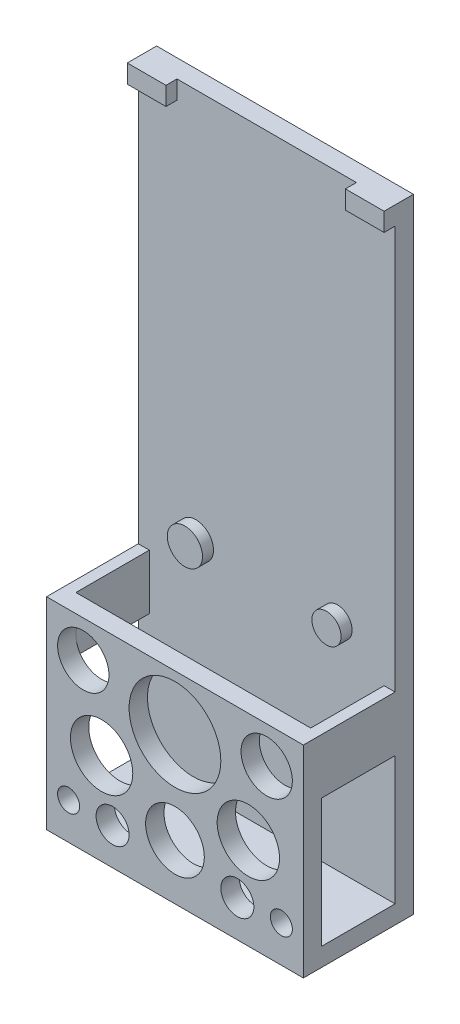
from build123d import *

# Parameters (mm, degrees)
SKETCH1_W           = 70
SKETCH1_H           = 170
BOSS_EXTRUDE1_DEPTH = 5
SKETCH2_W           = 70
SKETCH2_H           = 5
BOSS_EXTRUDE2_DEPTH = 25
SKETCH3_W           = 70
SKETCH3_H           = 5
BOSS_EXTRUDE3_DEPTH = 50
SKETCH4_W           = 3
SKETCH4_H           = 15
BOSS_EXTRUDE4_DEPTH = 20
CUT_EXTRUDE1_REACH  = 98.695
SKETCH6_R           = 12.5
SKETCH6_R_2         = 7
SKETCH6_R_3         = 8.5
SKETCH6_R_4         = 8
SKETCH6_R_5         = 4.5
SKETCH6_R_6         = 3
SKETCH7_R           = 4.797792648
SKETCH7_R_2         = 3.987535838
SKETCH7_W           = 10.549301712
SKETCH7_H           = 5.014130384
BOSS_EXTRUDE5_DEPTH = 3


with BuildPart() as part:
    # Sketch1 → Boss-Extrude1 (new body)
    with BuildSketch(Plane.XY):
        Rectangle(SKETCH1_W, SKETCH1_H)
    extrude(amount=BOSS_EXTRUDE1_DEPTH)

    # Sketch2 → Boss-Extrude2 (add)
    with BuildSketch(Plane.XY.offset(5)):
        with Locations((0, -82.5)):
            Rectangle(SKETCH2_W, SKETCH2_H)
    extrude(amount=BOSS_EXTRUDE2_DEPTH)

    # Sketch3 → Boss-Extrude3 (add)
    with BuildSketch(Plane(origin=(0, -80, 0), x_dir=(1, 0, 0), z_dir=(0, 1, 0))):
        with Locations((0, -27.5)):
            Rectangle(SKETCH3_W, SKETCH3_H)
    extrude(amount=BOSS_EXTRUDE3_DEPTH)

    # Sketch4 → Boss-Extrude4 (add)
    with BuildSketch(Plane.XY.offset(5)):
        with Locations((-33.5, -37.5)):
            Rectangle(SKETCH4_W, SKETCH4_H)
        with Locations((33.5, -37.5)):
            Rectangle(SKETCH4_W, SKETCH4_H)
    extrude(amount=BOSS_EXTRUDE4_DEPTH)

    # Sketch6 → Cut-Extrude1 (cut, up to next)
    with BuildSketch(Plane.XY.offset(30), mode=Mode.PRIVATE) as cut_extrude1_sk1:
        with Locations((0, -45)):
            Circle(SKETCH6_R)
    cut_extrude1_tool1 = extrude(cut_extrude1_sk1.sketch, amount=-CUT_EXTRUDE1_REACH, mode=Mode.PRIVATE) & part.part
    # Sketch6 → Cut-Extrude1 (cut, up to next)
    with BuildSketch(Plane.XY.offset(30), mode=Mode.PRIVATE) as cut_extrude1_sk2:
        with Locations((-25, -40)):
            Circle(SKETCH6_R_2)
    cut_extrude1_tool2 = extrude(cut_extrude1_sk2.sketch, amount=-CUT_EXTRUDE1_REACH, mode=Mode.PRIVATE) & part.part
    # Sketch6 → Cut-Extrude1 (cut, up to next)
    with BuildSketch(Plane.XY.offset(30), mode=Mode.PRIVATE) as cut_extrude1_sk3:
        with Locations((25, -40)):
            Circle(SKETCH6_R_2)
    cut_extrude1_tool3 = extrude(cut_extrude1_sk3.sketch, amount=-CUT_EXTRUDE1_REACH, mode=Mode.PRIVATE) & part.part
    # Sketch6 → Cut-Extrude1 (cut, up to next)
    with BuildSketch(Plane.XY.offset(30), mode=Mode.PRIVATE) as cut_extrude1_sk4:
        with Locations((-20, -60)):
            Circle(SKETCH6_R_3)
    cut_extrude1_tool4 = extrude(cut_extrude1_sk4.sketch, amount=-CUT_EXTRUDE1_REACH, mode=Mode.PRIVATE) & part.part
    # Sketch6 → Cut-Extrude1 (cut, up to next)
    with BuildSketch(Plane.XY.offset(30), mode=Mode.PRIVATE) as cut_extrude1_sk5:
        with Locations((20, -60)):
            Circle(SKETCH6_R_3)
    cut_extrude1_tool5 = extrude(cut_extrude1_sk5.sketch, amount=-CUT_EXTRUDE1_REACH, mode=Mode.PRIVATE) & part.part
    # Sketch6 → Cut-Extrude1 (cut, up to next)
    with BuildSketch(Plane.XY.offset(30), mode=Mode.PRIVATE) as cut_extrude1_sk6:
        with Locations((0, -70)):
            Circle(SKETCH6_R_4)
    cut_extrude1_tool6 = extrude(cut_extrude1_sk6.sketch, amount=-CUT_EXTRUDE1_REACH, mode=Mode.PRIVATE) & part.part
    # Sketch6 → Cut-Extrude1 (cut, up to next)
    with BuildSketch(Plane.XY.offset(30), mode=Mode.PRIVATE) as cut_extrude1_sk7:
        with Locations((-17, -75)):
            Circle(SKETCH6_R_5)
    cut_extrude1_tool7 = extrude(cut_extrude1_sk7.sketch, amount=-CUT_EXTRUDE1_REACH, mode=Mode.PRIVATE) & part.part
    # Sketch6 → Cut-Extrude1 (cut, up to next)
    with BuildSketch(Plane.XY.offset(30), mode=Mode.PRIVATE) as cut_extrude1_sk8:
        with Locations((17, -75)):
            Circle(SKETCH6_R_5)
    cut_extrude1_tool8 = extrude(cut_extrude1_sk8.sketch, amount=-CUT_EXTRUDE1_REACH, mode=Mode.PRIVATE) & part.part
    # Sketch6 → Cut-Extrude1 (cut, up to next)
    with BuildSketch(Plane.XY.offset(30), mode=Mode.PRIVATE) as cut_extrude1_sk9:
        with Locations((29, -75)):
            Circle(SKETCH6_R_6)
    cut_extrude1_tool9 = extrude(cut_extrude1_sk9.sketch, amount=-CUT_EXTRUDE1_REACH, mode=Mode.PRIVATE) & part.part
    # Sketch6 → Cut-Extrude1 (cut, up to next)
    with BuildSketch(Plane.XY.offset(30), mode=Mode.PRIVATE) as cut_extrude1_sk10:
        with Locations((-29, -75)):
            Circle(SKETCH6_R_6)
    cut_extrude1_tool10 = extrude(cut_extrude1_sk10.sketch, amount=-CUT_EXTRUDE1_REACH, mode=Mode.PRIVATE) & part.part
    add(cut_extrude1_tool1.solids().sort_by_distance((0, -45, 30))[0], mode=Mode.SUBTRACT)
    add(cut_extrude1_tool2.solids().sort_by_distance((-25, -40, 30))[0], mode=Mode.SUBTRACT)
    add(cut_extrude1_tool3.solids().sort_by_distance((25, -40, 30))[0], mode=Mode.SUBTRACT)
    add(cut_extrude1_tool4.solids().sort_by_distance((-20, -60, 30))[0], mode=Mode.SUBTRACT)
    add(cut_extrude1_tool5.solids().sort_by_distance((20, -60, 30))[0], mode=Mode.SUBTRACT)
    add(cut_extrude1_tool6.solids().sort_by_distance((0, -70, 30))[0], mode=Mode.SUBTRACT)
    add(cut_extrude1_tool7.solids().sort_by_distance((-17, -75, 30))[0], mode=Mode.SUBTRACT)
    add(cut_extrude1_tool8.solids().sort_by_distance((17, -75, 30))[0], mode=Mode.SUBTRACT)
    add(cut_extrude1_tool9.solids().sort_by_distance((29, -75, 30))[0], mode=Mode.SUBTRACT)
    add(cut_extrude1_tool10.solids().sort_by_distance((-29, -75, 30))[0], mode=Mode.SUBTRACT)

    # Sketch7 → Boss-Extrude5 (add)
    with BuildSketch(Plane.XY.offset(5)):
        with Locations((-19.294668455, -21.257959738)):
            Circle(SKETCH7_R)
        with Locations((19.294668455, -21.257959738)):
            Circle(SKETCH7_R_2)
        with Locations((-29.725349144, 82.492934808)):
            Rectangle(SKETCH7_W, SKETCH7_H)
        with Locations((29.725349144, 82.492934808)):
            Rectangle(SKETCH7_W, SKETCH7_H)
    extrude(amount=BOSS_EXTRUDE5_DEPTH)


solid = part.part
